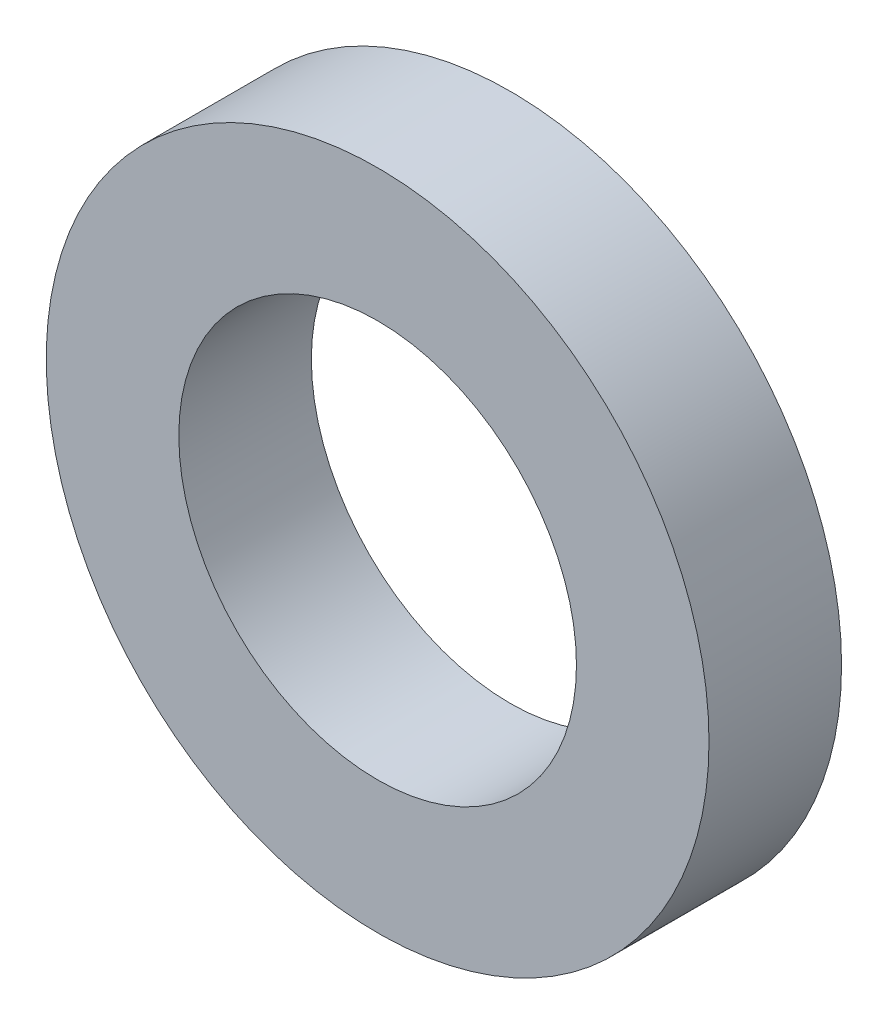
from build123d import *

# Parameters (mm, degrees)
SKETCH_1_R      = 2.5
SKETCH_1_R_2    = 1.5
EXTRUDE_1_DEPTH = 1


with BuildPart() as part:
    # 草图1 → 凸台-拉伸1 (new body)
    with BuildSketch(Plane.XY):
        Circle(SKETCH_1_R)
        Circle(SKETCH_1_R_2, mode=Mode.SUBTRACT)
    extrude(amount=EXTRUDE_1_DEPTH)


solid = part.part
